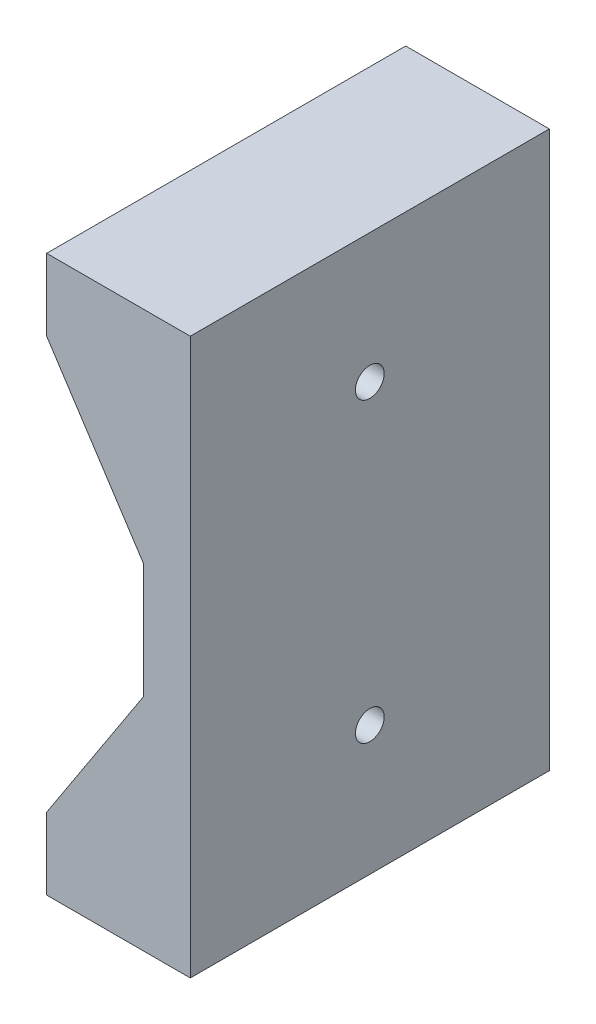
from build123d import *

# Parameters (mm, degrees)
SKETCH1_W           = 50
SKETCH1_H           = 77.4
SKETCH1_R           = 2
BOSS_EXTRUDE1_DEPTH = 3
SKETCH2_R           = 1.75
BOSS_EXTRUDE2_DEPTH = 17
SKETCH3_W           = 50
SKETCH3_H           = 16
BOSS_EXTRUDE3_DEPTH = 3.5
SKETCH6_W           = 30
SKETCH6_H           = 16
CUT_EXTRUDE3_DEPTH  = 3.5


with BuildPart() as part:
    # Sketch1 → Boss-Extrude1 (new body)
    with BuildSketch(Plane(origin=(15, 0, 0), x_dir=(0, 0, -1), z_dir=(1, 0, 0))):
        with Locations((-55.110705908, 0)):
            Rectangle(SKETCH1_W, SKETCH1_H)
        with Locations((-55.110705908, 20.7)):
            Circle(SKETCH1_R, mode=Mode.SUBTRACT)
        with Locations(Location((-55.110705908, -20.7, 0), (0, 0, 180))):
            Circle(SKETCH1_R, mode=Mode.SUBTRACT)
    extrude(amount=-BOSS_EXTRUDE1_DEPTH)

    # Sketch2 → Boss-Extrude2 (add)
    with BuildSketch(Plane.ZY.offset(-12)):
        with BuildLine():
            Line((30.110705908, 38.7), (80.110705908, 38.7))
            Line((80.110705908, 38.7), (80.110705908, 28.7))
            Line((80.110705908, 28.7), (67.799283448, 28.7))
            ThreePointArc((67.799283448, 28.7), (55.110705908, 35.7), (42.422128367, 28.7))
            Line((42.422128367, 28.7), (30.110705908, 28.7))
            Line((30.110705908, 28.7), (30.110705908, 38.7))
        make_face()
        with Locations((34.110705908, 33.7)):
            Circle(SKETCH2_R, mode=Mode.SUBTRACT)
        with Locations((41.110705908, 33.7)):
            Circle(SKETCH2_R, mode=Mode.SUBTRACT)
        with Locations((69.110705908, 33.7)):
            Circle(SKETCH2_R, mode=Mode.SUBTRACT)
        with Locations((76.110705908, 33.7)):
            Circle(SKETCH2_R, mode=Mode.SUBTRACT)
    boss_extrude2 = extrude(amount=BOSS_EXTRUDE2_DEPTH)

    # Mirror1: Boss-Extrude2 across plane
    add(boss_extrude2.mirror(Plane.ZX))

    # Sketch3 → Boss-Extrude3 (add)
    with BuildSketch(Plane.ZY.offset(-12)):
        with Locations((55.110705908, 0)):
            Rectangle(SKETCH3_W, SKETCH3_H)
    extrude(amount=BOSS_EXTRUDE3_DEPTH)

    # Sketch6 → Cut-Extrude3 (cut)
    with BuildSketch(Plane.ZY.offset(-8.5)):
        with Locations((55.110705908, 0)):
            Rectangle(SKETCH6_W, SKETCH6_H)
    extrude(amount=-CUT_EXTRUDE3_DEPTH, mode=Mode.SUBTRACT)

    # loft from a face of the part (loft2)
    loft([part.faces().sort_by_distance((3.5, 28.7, 36.266417138))[0], part.faces().sort_by_distance((10.25, 8, 35.110705908))[0]])

    # loft from a face of the part (loft3)
    loft([part.faces().sort_by_distance((10.25, 8, 75.110705908))[0], part.faces().sort_by_distance((3.5, 28.7, 73.954994678))[0]])

    # loft from a face of the part (loft4)
    loft([part.faces().sort_by_distance((10.25, -8, 35.110705908))[0], part.faces().sort_by_distance((3.5, -28.7, 36.266417138))[0]])

    # loft from a face of the part (loft5)
    loft([part.faces().sort_by_distance((3.5, -28.7, 73.954994678))[0], part.faces().sort_by_distance((10.25, -8, 75.110705908))[0]])


solid = part.part
